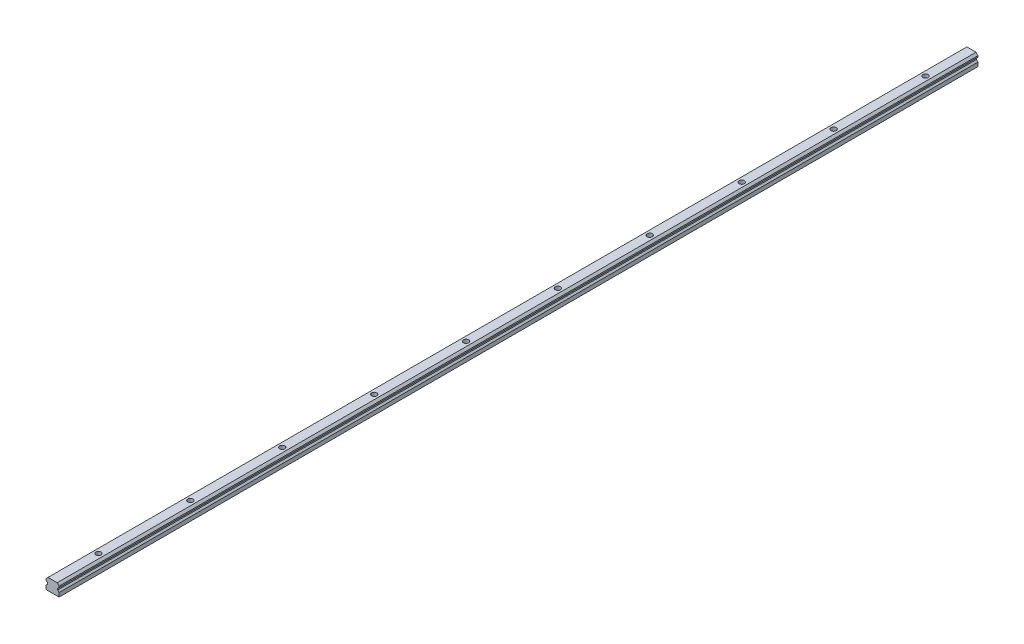
from build123d import *

# Parameters (mm, degrees)
BOSS_EXTRUDE1_DEPTH = 1400
SKETCH2_R           = 4
CUT_EXTRUDE1_DEPTH  = 26


with BuildPart() as part:
    # Sketch1 → Boss-Extrude1 (new body)
    with BuildSketch(Plane.XY):
        Polygon((-10, 0), (0, 0), (0, 17.5), (-7, 17.5), (-10, 14.5), (-10, 12.5), (-7.75, 10.25), (-7.75, 8.25), (-10, 6), align=None)
        Polygon((0, 17.5), (0, 0), (10, 0), (10, 6), (7.75, 8.25), (7.75, 10.25), (10, 12.5), (10, 14.5), (7, 17.5), align=None)
    extrude(amount=BOSS_EXTRUDE1_DEPTH)

    # Sketch2 → Cut-Extrude1 (cut)
    with BuildSketch(Plane(origin=(0, 17.5, 0), x_dir=(1, 0, 0), z_dir=(0, 1, 0))):
        with Locations(Location((0, -70, 0), (0, 0, 180))):
            Circle(SKETCH2_R)
        with Locations(Location((0, -210, 0), (0, 0, 180))):
            Circle(SKETCH2_R)
        with Locations(Location((0, -350, 0), (0, 0, 180))):
            Circle(SKETCH2_R)
        with Locations(Location((0, -490, 0), (0, 0, 180))):
            Circle(SKETCH2_R)
        with Locations(Location((0, -630, 0), (0, 0, 180))):
            Circle(SKETCH2_R)
        with Locations(Location((0, -770, 0), (0, 0, 180))):
            Circle(SKETCH2_R)
        with Locations(Location((0, -910, 0), (0, 0, 180))):
            Circle(SKETCH2_R)
        with Locations(Location((0, -1050, 0), (0, 0, 180))):
            Circle(SKETCH2_R)
        with Locations(Location((0, -1190, 0), (0, 0, 180))):
            Circle(SKETCH2_R)
        with Locations(Location((0, -1330, 0), (0, 0, 180))):
            Circle(SKETCH2_R)
    extrude(amount=-CUT_EXTRUDE1_DEPTH, mode=Mode.SUBTRACT)


solid = part.part
